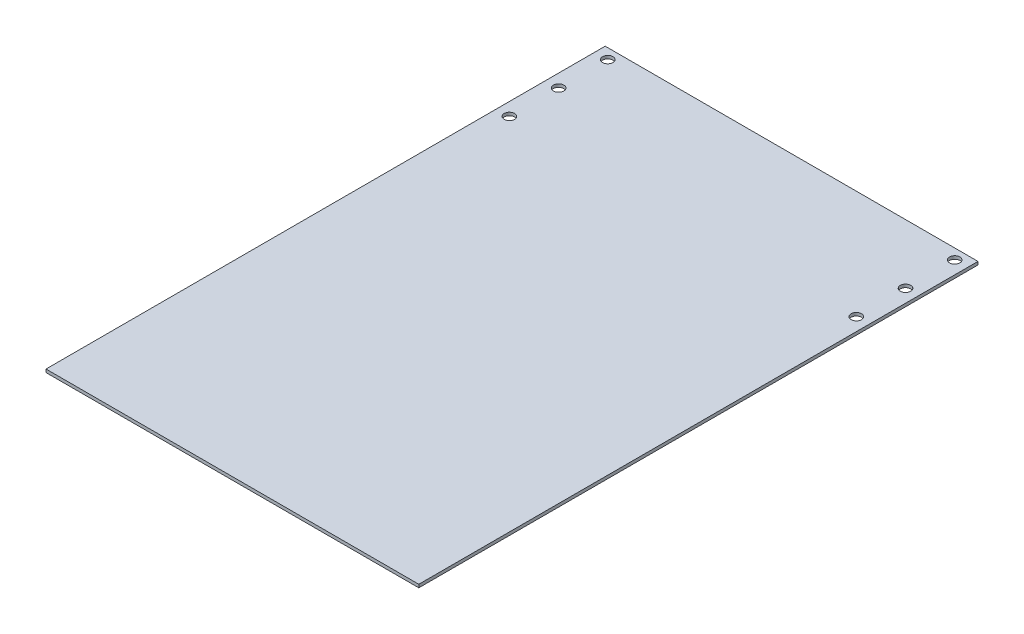
from build123d import *

# Parameters (mm, degrees)
SKETCH1_W               = 360
SKETCH1_H               = 540
BOSS_EXTRUDE1_DEPTH     = 3
CUT_EXTRUDE1_DEPTH      = 325.513482
CUT_EXTRUDE1_DEPTH_BACK = 325.513482
SKETCH2_R               = 5


with BuildPart() as part:
    # Sketch1 → Boss-Extrude1 (new body)
    with BuildSketch(Plane(origin=(0, 0, 0), x_dir=(1, 0, 0), z_dir=(0, 1, 0))):
        Rectangle(SKETCH1_W, SKETCH1_H)
    extrude(amount=BOSS_EXTRUDE1_DEPTH)

    # Sketch2 → Cut-Extrude1 (cut, two sides: drawn at the far end of the back side and taken through both)
    with BuildSketch(Plane(origin=(0, 3, 0), x_dir=(1, 0, 0), z_dir=(0, 1, 0)).offset(-CUT_EXTRUDE1_DEPTH_BACK)):
        with Locations(Location((-167.5, 212.5, 0), (0, 0, 270))):
            Circle(SKETCH2_R)
        with Locations(Location((-167.5, 165, 0), (0, 0, 270))):
            Circle(SKETCH2_R)
        with Locations(Location((-167.5, 260, 0), (0, 0, 90))):
            Circle(SKETCH2_R)
        with Locations(Location((167.5, 260, 0), (0, 0, 270))):
            Circle(SKETCH2_R)
        with Locations(Location((167.5, 165, 0), (0, 0, 90))):
            Circle(SKETCH2_R)
        with Locations(Location((167.5, 212.5, 0), (0, 0, 90))):
            Circle(SKETCH2_R)
    extrude(amount=CUT_EXTRUDE1_DEPTH + CUT_EXTRUDE1_DEPTH_BACK, mode=Mode.SUBTRACT)


solid = part.part
